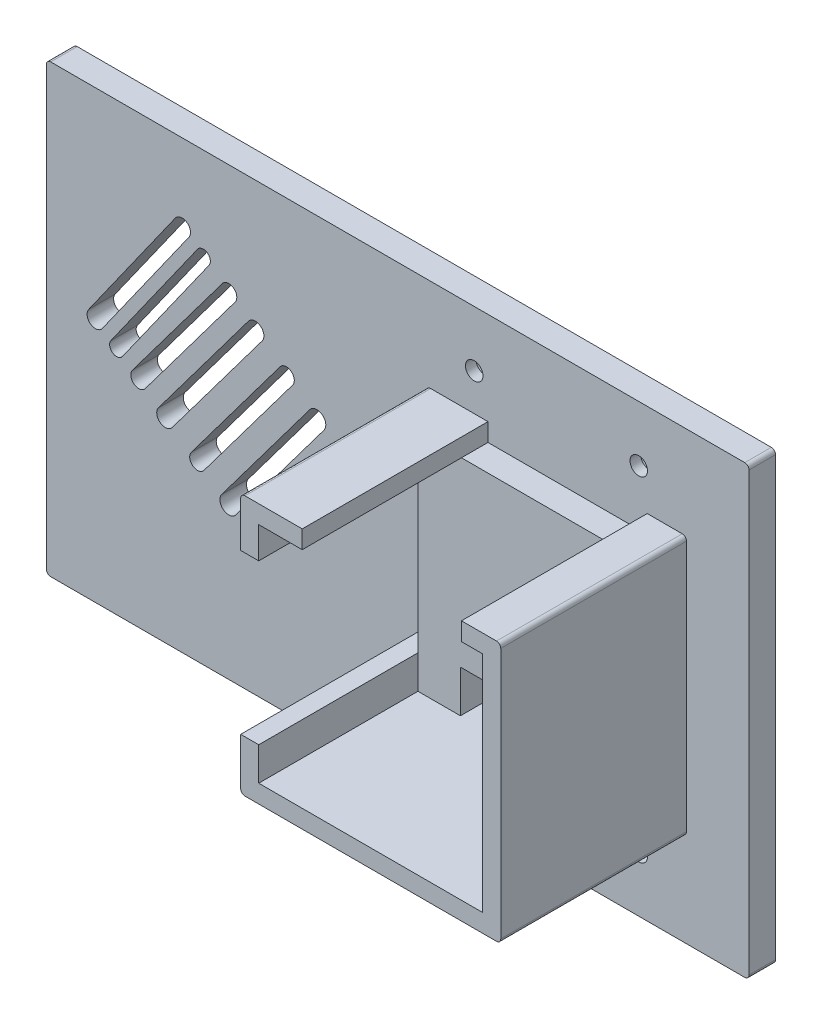
from build123d import *

# Parameters (mm, degrees)
SKETCH_1_W          = 150
SKETCH_1_H          = 84
EXTRUDE_1_DEPTH     = 5
SKETCH_2_W          = 49
SKETCH_2_H          = 49
EXTRUDE_2_DEPTH     = 35
SKETCH_3_W          = 35
SKETCH_3_H          = 30
CUT_EXTRUDE_1_DEPTH = 21
SKETCH_4_W          = 30
SKETCH_4_H          = 35
CUT_EXTRUDE_2_DEPTH = 21
FILLET_1_R          = 0.8
CUT_EXTRUDE_3_DEPTH = 21
SKETCH_6_W          = 27.415053397
SKETCH_6_H          = 84
CUT_EXTRUDE_4_DEPTH = 21
FILLET_2_R          = 0.8
EXTRUDE_5_DEPTH     = 5
SKETCH_12_R         = 1.65
CUT_EXTRUDE_5_DEPTH = 10
SKETCH_13_R         = 3
CUT_EXTRUDE_6_DEPTH = 3


with BuildPart() as part:
    # 草图1 → 凸台-拉伸1 (new body)
    with BuildSketch(Plane.XY):
        Rectangle(SKETCH_1_W, SKETCH_1_H)
    extrude(amount=EXTRUDE_1_DEPTH)

    # 草图2 → 凸台-拉伸2 (add)
    with BuildSketch(Plane.XY.offset(5)):
        with Locations((21.1, 0)):
            Rectangle(SKETCH_2_W, SKETCH_2_H)
        Polygon((0, 0), (0, 21.1), (42.2, 21.1), (42.2, -21.1), (0, -21.1), align=None, mode=Mode.SUBTRACT)
    extrude(amount=EXTRUDE_2_DEPTH)

    # 草图3 → 切除-拉伸1 (cut)
    with BuildSketch(Plane.ZY.offset(3.4)):
        with Locations((22.5, 0.18053777)):
            Rectangle(SKETCH_3_W, SKETCH_3_H)
    extrude(amount=-CUT_EXTRUDE_1_DEPTH, mode=Mode.SUBTRACT)

    # 草图4 → 切除-拉伸2 (cut)
    with BuildSketch(Plane(origin=(0, 24.5, 0), x_dir=(1, 0, 0), z_dir=(0, 1, 0))):
        with Locations((23.194652979, -22.5)):
            Rectangle(SKETCH_4_W, SKETCH_4_H)
    extrude(amount=-CUT_EXTRUDE_2_DEPTH, mode=Mode.SUBTRACT)

    # 圆角1
    fillet_1_edges = [part.edges().sort_by_distance(p)[0] for p in [
        (45.6, -24.5, 22.5),
        (45.6, 24.5, 22.5),
        (-3.4, 24.5, 22.5),
        (-3.4, -24.5, 22.5),
        (75, -42, 2.5),
        (-75, -42, 2.5),
        (-75, 42, 2.5),
        (75, 42, 2.5),
    ]]
    fillet(fillet_1_edges, radius=FILLET_1_R)

    # 草图5 → 切除-拉伸3 (cut)
    with BuildSketch(Plane.XY.offset(5)):
        with BuildLine():
            Line((-48.149197029, 26.428665041), (-64.478381839, 3.358073657))
            ThreePointArc((-64.478381839, 3.358073657), (-66.677650185, 2.98177299), (-67.053950852, 5.181041335))
            Line((-67.053950852, 5.181041335), (-50.724766042, 28.251632719))
            ThreePointArc((-50.724766042, 28.251632719), (-48.525497697, 28.627933386), (-48.149197029, 26.428665041))
        make_face()
        with BuildLine():
            Line((-44.360375577, 23.74696674), (-60.689560387, 0.676375357))
            ThreePointArc((-60.689560387, 0.676375357), (-62.535750423, 0.360487328), (-62.851638452, 2.206677363))
            Line((-62.851638452, 2.206677363), (-46.522453641, 25.277268747))
            ThreePointArc((-46.522453641, 25.277268747), (-44.676263606, 25.593156775), (-44.360375577, 23.74696674))
        make_face()
        with BuildLine():
            Line((-39.434375371, 20.209781933), (-56.396344169, -2.412929875))
            ThreePointArc((-56.396344169, -2.412929875), (-58.505226428, -2.71450716), (-58.806803713, -0.605624901))
            Line((-58.806803713, -0.605624901), (-41.844834915, 22.017086907))
            ThreePointArc((-41.844834915, 22.017086907), (-39.735952656, 22.318664192), (-39.434375371, 20.209781933))
        make_face()
        with BuildLine():
            Line((-34.352361813, 16.39940959), (-51.314330611, -6.223302218))
            ThreePointArc((-51.314330611, -6.223302218), (-53.573704294, -6.546400285), (-53.896802361, -4.287026602))
            Line((-53.896802361, -4.287026602), (-36.934833563, 18.335685206))
            ThreePointArc((-36.934833563, 18.335685206), (-34.67545988, 18.658783273), (-34.352361813, 16.39940959))
        make_face()
        with BuildLine():
            Line((-28.599059516, 12.085720989), (-45.333964099, -10.234148128))
            ThreePointArc((-45.333964099, -10.234148128), (-47.413554704, -10.531536607), (-47.710943184, -8.451946002))
            Line((-47.710943184, -8.451946002), (-30.976038601, 13.867923114))
            ThreePointArc((-30.976038601, 13.867923114), (-28.896447996, 14.165311594), (-28.599059516, 12.085720989))
        make_face()
        with BuildLine():
            Line((-22.701866689, 7.664146707), (-39.300291247, -14.473694703))
            ThreePointArc((-39.300291247, -14.473694703), (-41.643790703, -14.80882304), (-41.97891904, -12.465323584))
            Line((-41.97891904, -12.465323584), (-25.380494482, 9.672517826))
            ThreePointArc((-25.380494482, 9.672517826), (-23.036995026, 10.007646163), (-22.701866689, 7.664146707))
        make_face()
    extrude(amount=-CUT_EXTRUDE_3_DEPTH, mode=Mode.SUBTRACT)

    # 草图6 → 切除-拉伸4 (cut)
    with BuildSketch(Plane.XY.offset(5)):
        with Locations((71.084387087, 0)):
            Rectangle(SKETCH_6_W, SKETCH_6_H)
    extrude(amount=-CUT_EXTRUDE_4_DEPTH, mode=Mode.SUBTRACT)

    # 圆角2
    fillet_2_edges = [part.edges().sort_by_distance(p)[0] for p in [
        (57.376860388, -42, 2.5),
        (57.376860388, 42, 2.5),
    ]]
    fillet(fillet_2_edges, radius=FILLET_2_R)

    # 草图10 → 凸台-拉伸5 (add)
    with BuildSketch(Plane.XY.offset(5)):
        Polygon((0, 21.1), (0, -21.1), (8, -21.1), (8, -13.15), (34.3, -13.15), (34.3, -21.1), (42.2, -21.1), (42.2, 21.1), align=None)
    extrude(amount=EXTRUDE_5_DEPTH)

    # 草图12 → 切除-拉伸5 (cut)
    with BuildSketch(Plane.XY.offset(5)):
        with Locations((5.6, -31.5)):
            Circle(SKETCH_12_R)
        with Locations((5.6, 31.5)):
            Circle(SKETCH_12_R)
        with Locations((36.6, -31.5)):
            Circle(SKETCH_12_R)
        with Locations((36.6, 31.5)):
            Circle(SKETCH_12_R)
    extrude(amount=-CUT_EXTRUDE_5_DEPTH, mode=Mode.SUBTRACT)

    # 草图13 → 切除-拉伸6 (cut)
    with BuildSketch(Plane(origin=(0, 0, 0), x_dir=(-1, 0, 0), z_dir=(0, 0, -1))):
        with Locations((-5.6, 31.5)):
            Circle(SKETCH_13_R)
        with Locations((-5.6, -31.5)):
            Circle(SKETCH_13_R)
        with Locations(Location((-36.6, -31.5, 0), (0, 0, 180))):
            Circle(SKETCH_13_R)
        with Locations(Location((-36.6, 31.5, 0), (0, 0, 180))):
            Circle(SKETCH_13_R)
    extrude(amount=-CUT_EXTRUDE_6_DEPTH, mode=Mode.SUBTRACT)


solid = part.part
